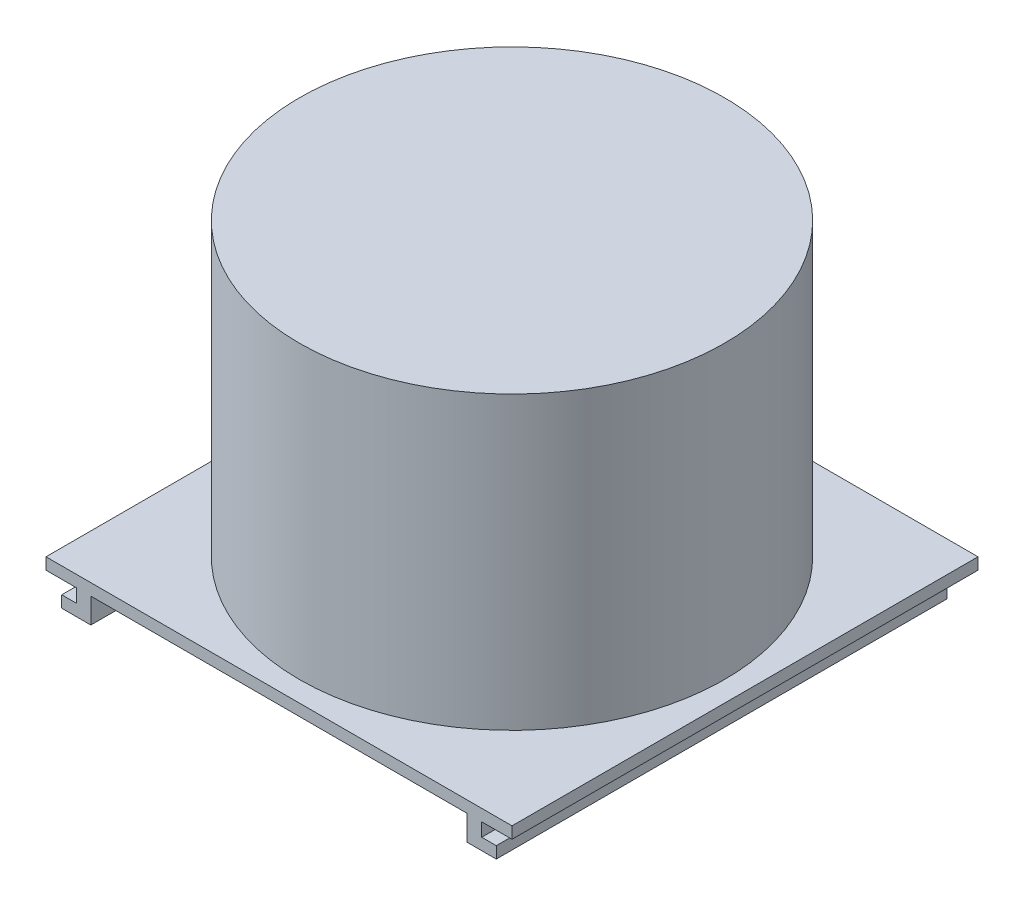
from build123d import *

# Parameters (mm, degrees)
SKETCH1_W           = 80
SKETCH1_H           = 80
SKETCH1_R           = 36.5
SKETCH1_R_2         = 35
BOSS_EXTRUDE3_DEPTH = 2
BOSS_EXTRUDE4_START = 50
SKETCH1_7_R         = 36.5
SKETCH1_7_R_2       = 35
BOSS_EXTRUDE4_DEPTH = 50
BOSS_EXTRUDE5_DEPTH = 77.35
SKETCH4_R           = 36
BOSS_EXTRUDE6_DEPTH = 1.5


with BuildPart() as part:
    # Sketch1 → Boss-Extrude3 (new body)
    # profile 1 of 2: a face of its own
    with BuildSketch(Plane(origin=(0, 0, 0), x_dir=(1, 0, 0), z_dir=(0, 1, 0))):
        Rectangle(SKETCH1_W, SKETCH1_H)
        Circle(SKETCH1_R, mode=Mode.SUBTRACT)
    # profile 2 of 2: a face of its own
    with BuildSketch(Plane(origin=(0, 0, 0), x_dir=(1, 0, 0), z_dir=(0, 1, 0))):
        Circle(SKETCH1_R)
        with Locations(Location((0, 0, 0), (0, 0, 270))):
            Circle(SKETCH1_R_2, mode=Mode.SUBTRACT)
    extrude(amount=-BOSS_EXTRUDE3_DEPTH)

    # Sketch1<7> → Boss-Extrude4 (add)
    with BuildSketch(Plane(origin=(0, 0, 0), x_dir=(1, 0, 0), z_dir=(0, 1, 0)).offset(BOSS_EXTRUDE4_START)):
        with Locations(Location((0, 0, 0), (0, 0, 270))):
            Circle(SKETCH1_7_R)
        with Locations(Location((0, 0, 0), (0, 0, 270))):
            Circle(SKETCH1_7_R_2, mode=Mode.SUBTRACT)
    extrude(amount=-BOSS_EXTRUDE4_DEPTH)

    # Sketch3 → Boss-Extrude5 (add)
    with BuildSketch(Plane.XY.offset(40)):
        Polygon((-32.3, -2), (-34.8, -2), (-34.8, -4.3), (-37.3, -4.3), (-37.3, -6.3), (-32.3, -6.3), align=None)
        Polygon((32.3, -6.3), (37.3, -6.3), (37.3, -4.3), (34.8, -4.3), (34.8, -2), (32.3, -2), align=None)
    extrude(amount=-BOSS_EXTRUDE5_DEPTH)

    # Sketch4 → Boss-Extrude6 (add)
    with BuildSketch(Plane(origin=(0, 50, 0), x_dir=(1, 0, 0), z_dir=(0, 1, 0))):
        Circle(SKETCH4_R)
    extrude(amount=-BOSS_EXTRUDE6_DEPTH)


solid = part.part
